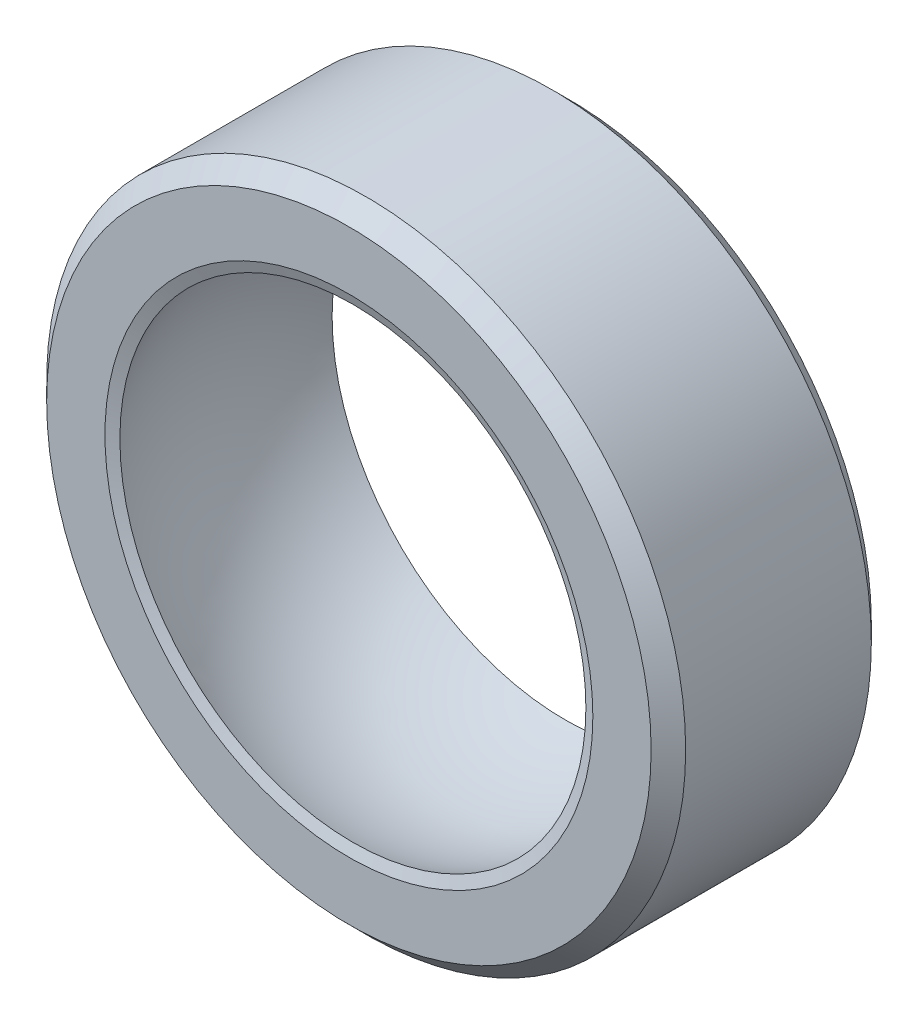
from build123d import *


with BuildPart() as part:
    # Sketch1 → Revolve1 (revolve)
    with BuildSketch(Plane(origin=(0, 0, 0), x_dir=(1, 0, 0), z_dir=(0, 1, 0))):
        with BuildLine():
            Line((-9.398, 2.7305), (-9.398, -2.7305))
            Line((-9.398, -2.7305), (-8.89, -3.2385))
            Line((-8.89, -3.2385), (-7.17579, -3.2385))
            Line((-7.17579, -3.2385), (-6.85385, -3.12139))
            ThreePointArc((-6.85385, -3.12139), (-7.531157637, 0), (-6.85385, 3.12139))
            Line((-6.85385, 3.12139), (-7.17579, 3.2385))
            Line((-7.17579, 3.2385), (-8.89, 3.2385))
            Line((-8.89, 3.2385), (-9.398, 2.7305))
        make_face()
    revolve(axis=Axis((0, 0, 3), (0, 0, -1)))


solid = part.part
